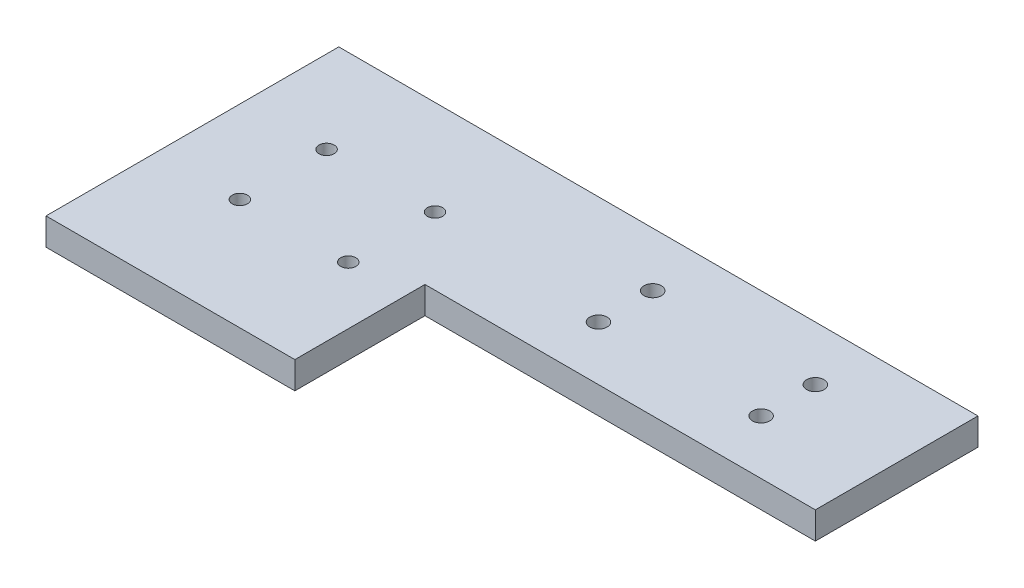
from build123d import *

# Parameters (mm, degrees)
SKETCH1_R           = 1.4
SKETCH1_R_2         = 1.6
SKETCH1_W           = 8
SKETCH1_H           = 24
BOSS_EXTRUDE1_DEPTH = 5


with BuildPart() as part:
    # Sketch1 → Boss-Extrude1 (new body)
    # profile 1 of 3: a face of its own
    with BuildSketch(Plane(origin=(0, 0, 0), x_dir=(1, 0, 0), z_dir=(0, 1, 0))):
        Polygon((0, -30), (0, 0), (-37.9, 0), (-37.9, -35), (-37.9, -54), (0, -54), align=None)
        with Locations(Location((-22.65, -33.5, 0), (0, 0, 270))):
            Circle(SKETCH1_R, mode=Mode.SUBTRACT)
        with Locations(Location((-2.65, -33.5, 0), (0, 0, 270))):
            Circle(SKETCH1_R, mode=Mode.SUBTRACT)
        with Locations(Location((-22.65, -17.5, 0), (0, 0, 270))):
            Circle(SKETCH1_R, mode=Mode.SUBTRACT)
        with Locations(Location((-2.65, -17.5, 0), (0, 0, 270))):
            Circle(SKETCH1_R, mode=Mode.SUBTRACT)
    # profile 2 of 3: a face of its own
    with BuildSketch(Plane(origin=(0, 0, 0), x_dir=(1, 0, 0), z_dir=(0, 1, 0))):
        Polygon((80, 0), (0, 0), (0, -30), (8, -30), (80, -30), align=None)
        with Locations(Location((30, -20, 0), (0, 0, 270))):
            Circle(SKETCH1_R_2, mode=Mode.SUBTRACT)
        with Locations(Location((60, -20, 0), (0, 0, 270))):
            Circle(SKETCH1_R_2, mode=Mode.SUBTRACT)
        with Locations(Location((30, -10, 0), (0, 0, 270))):
            Circle(SKETCH1_R_2, mode=Mode.SUBTRACT)
        with Locations(Location((60, -10, 0), (0, 0, 270))):
            Circle(SKETCH1_R_2, mode=Mode.SUBTRACT)
    # profile 3 of 3: a face of its own
    with BuildSketch(Plane(origin=(0, 0, 0), x_dir=(1, 0, 0), z_dir=(0, 1, 0))):
        with Locations((4, -42)):
            Rectangle(SKETCH1_W, SKETCH1_H)
    extrude(amount=BOSS_EXTRUDE1_DEPTH)


solid = part.part
